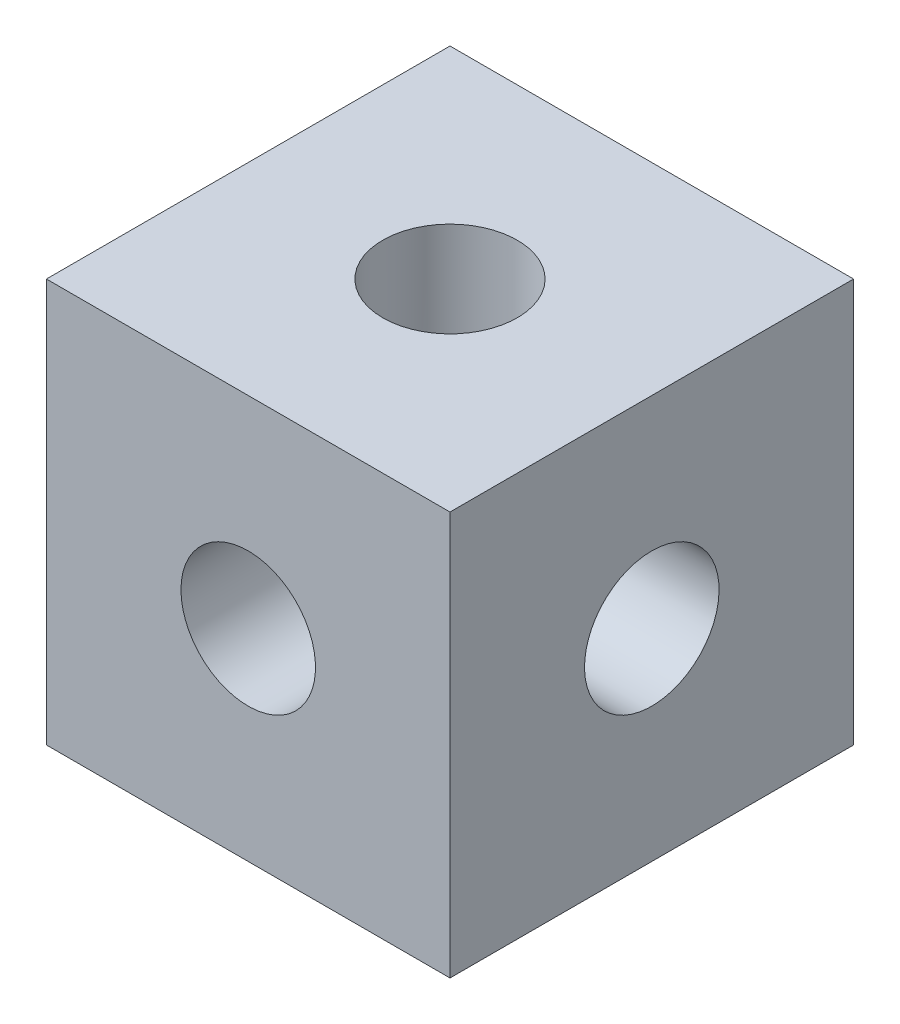
from build123d import *

# Parameters (mm, degrees)
SKETCH_1_W          = 12
SKETCH_1_H          = 12
EXTRUDE_1_DEPTH     = 12
SKETCH_2_R          = 2
CUT_EXTRUDE_1_DEPTH = 21.784609691
SKETCH_3_R          = 2
CUT_EXTRUDE_2_DEPTH = 21.784609691
SKETCH_4_R          = 2
CUT_EXTRUDE_3_DEPTH = 21.784609691


with BuildPart() as part:
    # 草图1 → 凸台-拉伸1 (new body)
    with BuildSketch(Plane.XY):
        with Locations((6, -6)):
            Rectangle(SKETCH_1_W, SKETCH_1_H)
    extrude(amount=EXTRUDE_1_DEPTH)

    # 草图2 → 切除-拉伸1 (cut, through all)
    with BuildSketch(Plane(origin=(12, 0, 0), x_dir=(0, 0, -1), z_dir=(1, 0, 0))):
        with Locations(Location((-6, -6, 0), (0, 0, 90))):
            Circle(SKETCH_2_R)
    extrude(amount=-CUT_EXTRUDE_1_DEPTH, mode=Mode.SUBTRACT)

    # 草图3 → 切除-拉伸2 (cut, through all)
    with BuildSketch(Plane(origin=(0, 0, 0), x_dir=(1, 0, 0), z_dir=(0, 1, 0))):
        with Locations(Location((6, -6, 0), (0, 0, 270))):
            Circle(SKETCH_3_R)
    extrude(amount=-CUT_EXTRUDE_2_DEPTH, mode=Mode.SUBTRACT)

    # 草图4 → 切除-拉伸3 (cut, through all)
    with BuildSketch(Plane(origin=(0, 0, 0), x_dir=(-1, 0, 0), z_dir=(0, 0, -1))):
        with Locations((-6, -6)):
            Circle(SKETCH_4_R)
    extrude(amount=-CUT_EXTRUDE_3_DEPTH, mode=Mode.SUBTRACT)


solid = part.part
